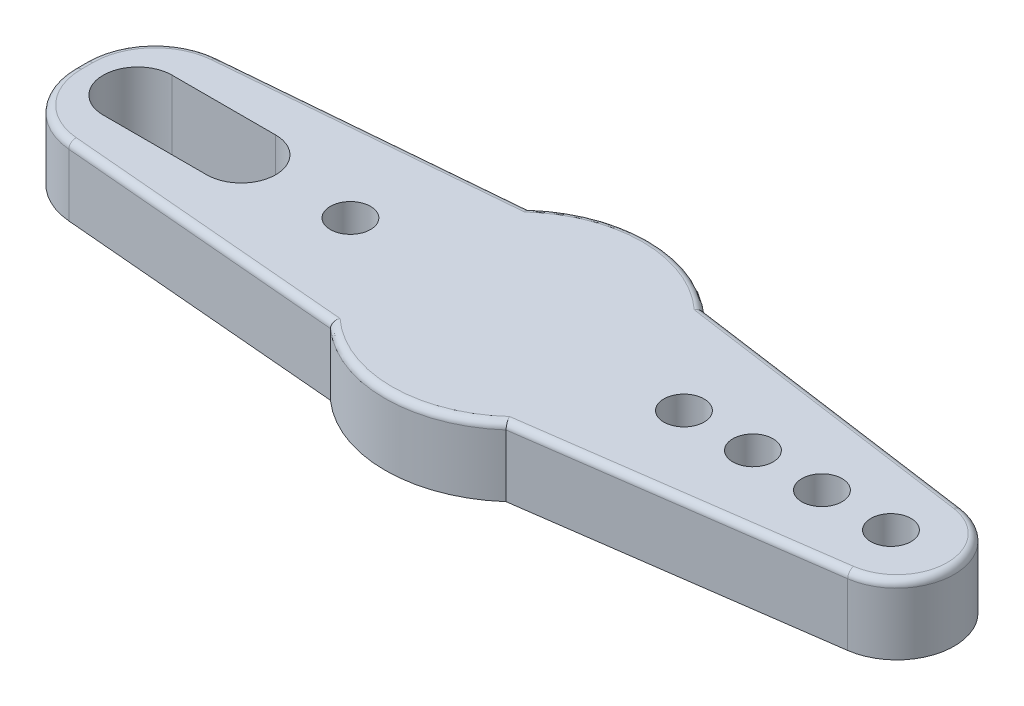
from build123d import *

# Parameters (mm, degrees)
SKETCH1_R           = 0.875
SKETCH1_R_2         = 3.5
BOSS_EXTRUDE1_DEPTH = 3
BOSS_EXTRUDE2_START = -2
SKETCH2_R           = 3.5
BOSS_EXTRUDE2_DEPTH = 2
FILLET1_R           = 3
FILLET2_R           = 0.3


with BuildPart() as part:
    # Sketch1 → Boss-Extrude1 (new body)
    with BuildSketch(Plane(origin=(0, 8.778505218, 0), x_dir=(1, 0, 0), z_dir=(0, 1, 0))):
        with BuildLine():
            Line((24.483909442, -36.009383283), (39.666515042, -34.709383283))
            ThreePointArc((39.666515042, -34.709383283), (43.483909442, -33.259383283), (47.301303841, -34.709383283))
            Line((47.301303841, -34.709383283), (60.330539136, -36.533530328))
            ThreePointArc((60.330539136, -36.533530328), (62.483909442, -39.009383283), (60.330539136, -41.485236238))
            Line((60.330539136, -41.485236238), (47.301303841, -43.309383283))
            ThreePointArc((47.301303841, -43.309383283), (43.483909442, -44.759383283), (39.666515042, -43.309383283))
            Line((39.666515042, -43.309383283), (24.483909442, -42.009383283))
            Line((24.483909442, -42.009383283), (24.483909442, -36.009383283))
        make_face()
        with Locations(Location((36.233909442, -39.009383283, 0), (0, 0, 270))):
            Circle(SKETCH1_R, mode=Mode.SUBTRACT)
        with Locations(Location((50.733909442, -39.009383283, 0), (0, 0, 270))):
            Circle(SKETCH1_R, mode=Mode.SUBTRACT)
        with Locations(Location((53.733909442, -39.009383283, 0), (0, 0, 270))):
            Circle(SKETCH1_R, mode=Mode.SUBTRACT)
        with Locations(Location((56.733909442, -39.009383283, 0), (0, 0, 270))):
            Circle(SKETCH1_R, mode=Mode.SUBTRACT)
        with Locations(Location((59.733909442, -39.009383283, 0), (0, 0, 270))):
            Circle(SKETCH1_R, mode=Mode.SUBTRACT)
        with Locations(Location((43.483909442, -39.009383283, 0), (0, 0, 270))):
            Circle(SKETCH1_R_2, mode=Mode.SUBTRACT)
        with BuildLine():
            Line((26.983909442, -37.509383283), (31.483909442, -37.509383283))
            ThreePointArc((31.483909442, -37.509383283), (32.983909442, -39.009383283), (31.483909442, -40.509383283))
            Line((31.483909442, -40.509383283), (26.983909442, -40.509383283))
            ThreePointArc((26.983909442, -40.509383283), (25.483909442, -39.009383283), (26.983909442, -37.509383283))
        make_face(mode=Mode.SUBTRACT)
    extrude(amount=BOSS_EXTRUDE1_DEPTH)

    # Sketch2 → Boss-Extrude2 (add)
    with BuildSketch(Plane(origin=(0, 11.778505218, 0), x_dir=(1, 0, 0), z_dir=(0, 1, 0)).offset(BOSS_EXTRUDE2_START)):
        with Locations(Location((43.483909442, -39.009383283, 0), (0, 0, 270))):
            Circle(SKETCH2_R)
    extrude(amount=BOSS_EXTRUDE2_DEPTH)

    # Fillet1
    fillet1_edges = [part.edges().sort_by_distance(p)[0] for p in [
        (24.483909442, 10.278505218, 42.009383283),
        (24.483909442, 10.278505218, 36.009383283),
    ]]
    fillet(fillet1_edges, radius=FILLET1_R)

    # Fillet2
    fillet2_edges = [part.edges().sort_by_distance(p)[0] for p in [
        (43.483909442, 11.778505218, 44.759383283),
        (53.815921489, 11.778505218, 42.39730976),
        (62.483909442, 11.778505218, 39.009383283),
        (53.815921489, 11.778505218, 35.621456805),
        (43.483909442, 11.778505218, 33.259383283),
        (33.447244034, 11.778505218, 42.776862547),
        (24.483909442, 11.778505218, 39.009383283),
        (33.447244034, 11.778505218, 35.241904019),
        (25.273953645, 11.778505218, 36.734671327),
        (25.273953645, 11.778505218, 41.284095239),
    ]]
    fillet(fillet2_edges, radius=FILLET2_R)


solid = part.part
